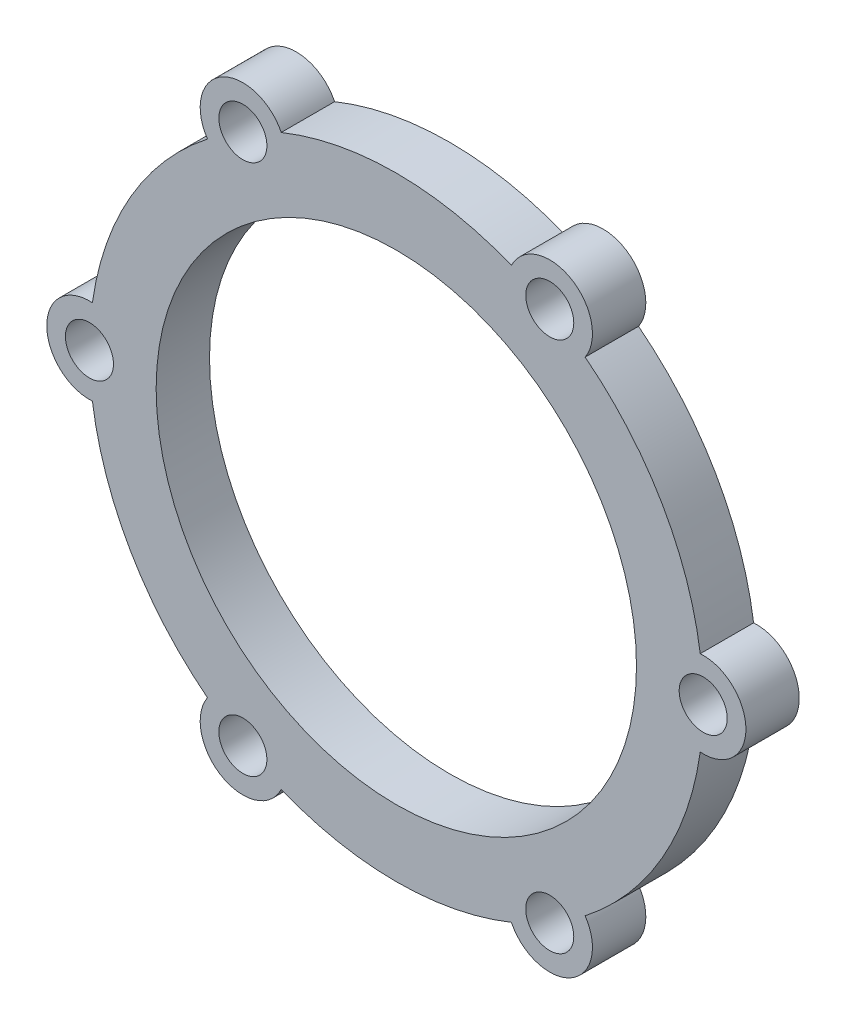
from build123d import *

# Parameters (mm, degrees)
SKETCH1_R           = 57.5
SKETCH1_R_2         = 45
EXTRUDE_THIN1_DEPTH = 5
SKETCH2_R           = 8
BOSS_EXTRUDE1_DEPTH = 10
SKETCH3_R           = 4.5
CUT_EXTRUDE1_DEPTH  = 88.729698506
CIRPATTERN1_COUNT   = 6


with BuildPart() as part:
    # Sketch1 → Extrude-Thin1 (new, symmetric)
    with BuildSketch(Plane(origin=(0, 0, 0), x_dir=(0, 1, 0), z_dir=(0, 0, 1))):
        Circle(SKETCH1_R)
        Circle(SKETCH1_R_2, mode=Mode.SUBTRACT)
    extrude(amount=EXTRUDE_THIN1_DEPTH, both=True)

    # Sketch2 → Boss-Extrude1 (add)
    with BuildSketch(Plane.XY.offset(5)):
        with Locations((57.5, 0)):
            Circle(SKETCH2_R)
    boss_extrude1 = extrude(amount=-BOSS_EXTRUDE1_DEPTH)

    # Sketch3 → Cut-Extrude1 (cut, symmetric)
    with BuildSketch(Plane.XY.offset(5)):
        with Locations((57.5, 0)):
            Circle(SKETCH3_R)
    cut_extrude1 = extrude(amount=CUT_EXTRUDE1_DEPTH, both=True, mode=Mode.SUBTRACT)

    # CirPattern1: Boss-Extrude1, Cut-Extrude1 ×6 about axis
    cirpattern1_axis = Axis((0, 0, 0), (0, 0, 1))
    add([boss_extrude1.rotate(cirpattern1_axis, i * 360 / CIRPATTERN1_COUNT) for i in range(1, CIRPATTERN1_COUNT)])
    add([cut_extrude1.rotate(cirpattern1_axis, i * 360 / CIRPATTERN1_COUNT) for i in range(1, CIRPATTERN1_COUNT)], mode=Mode.SUBTRACT)


solid = part.part
